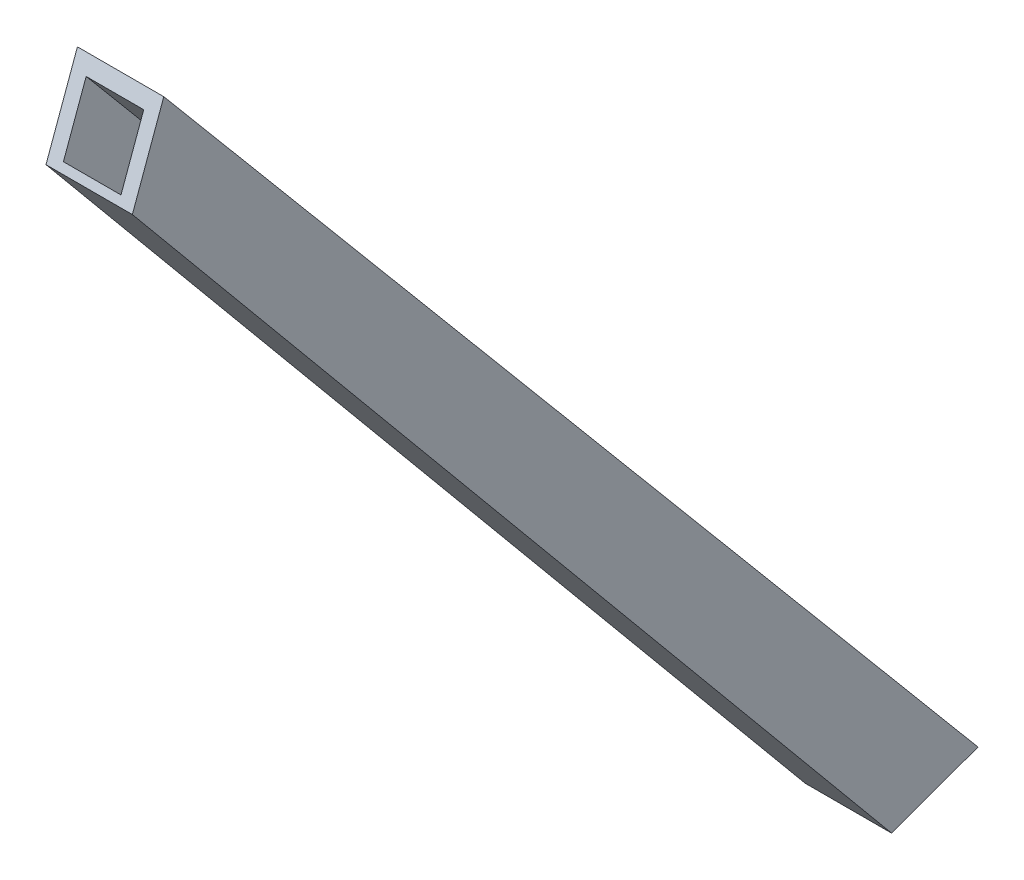
from build123d import *

# Parameters (mm, degrees)
BOSS_EXTRUDE1_DEPTH     = 19.05
CUT_EXTRUDE1_DEPTH      = 295.751251025
CUT_EXTRUDE1_DEPTH_BACK = 295.751251025
SKETCH2_W               = 12.7
SKETCH2_H               = 12.7


with BuildPart() as part:
    # Sketch1 → Boss-Extrude1 (new body)
    with BuildSketch(Plane(origin=(0, 0, 0), x_dir=(0, 0, -1), z_dir=(1, 0, 0))):
        Polygon((249.444858146, -198.74145037), (268.494858146, -191.807817407), (94.609985754, 15.420103965), (88.9, 22.225), (81.966367037, 3.175), align=None)
    extrude(amount=BOSS_EXTRUDE1_DEPTH)

    # Sketch2 → Cut-Extrude1 (cut, two sides: drawn at the far end of the back side and taken through both)
    with BuildSketch(Plane(origin=(0, -244.765356655, -205.382520494), x_dir=(-1, 0, 0), z_dir=(0, -0.766044443118953, -0.6427876096865692)).offset(-CUT_EXTRUDE1_DEPTH_BACK)):
        with Locations((-9.525, 72.862305619)):
            Rectangle(SKETCH2_W, SKETCH2_H)
    extrude(amount=CUT_EXTRUDE1_DEPTH + CUT_EXTRUDE1_DEPTH_BACK, mode=Mode.SUBTRACT)


solid = part.part
